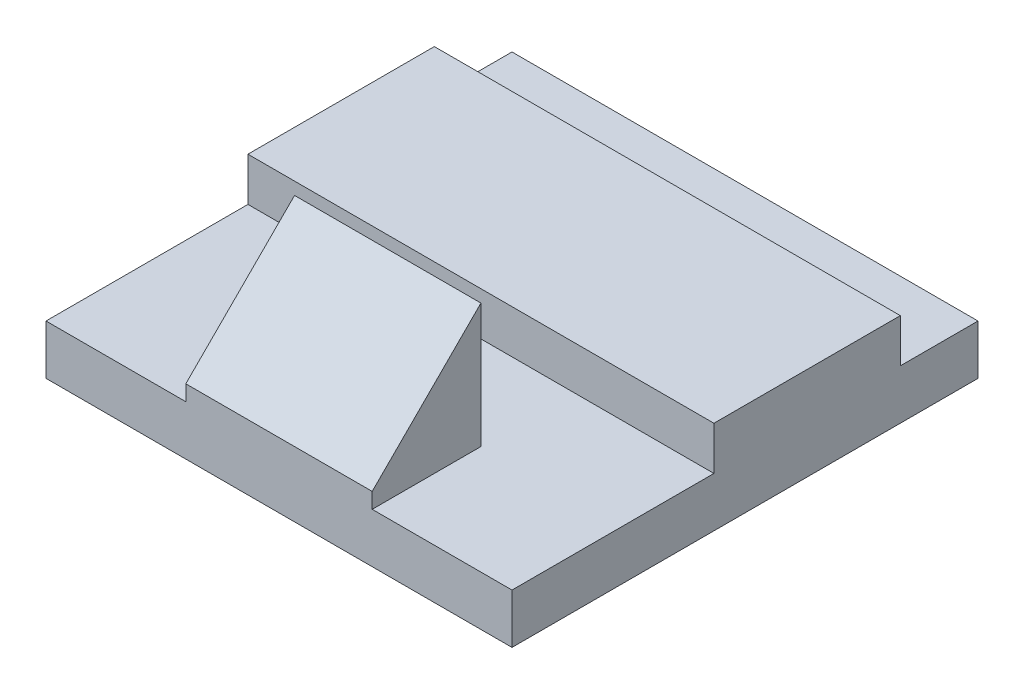
from build123d import *

# Parameters (mm, degrees)
SKETCH1_W           = 300
SKETCH1_H           = 300
BOSS_EXTRUDE1_DEPTH = 32
SKETCH2_W           = 300
SKETCH2_H           = 120
BOSS_EXTRUDE2_DEPTH = 28
SKETCH3_W           = 120
SKETCH3_H           = 70
BOSS_EXTRUDE3_DEPTH = 80
CUT_EXTRUDE1_DEPTH  = 120


with BuildPart() as part:
    # Sketch1 → Boss-Extrude1 (new body)
    with BuildSketch(Plane(origin=(0, 0, 0), x_dir=(1, 0, 0), z_dir=(0, 1, 0))):
        Rectangle(SKETCH1_W, SKETCH1_H)
    extrude(amount=BOSS_EXTRUDE1_DEPTH)

    # Sketch2 → Boss-Extrude2 (add)
    with BuildSketch(Plane(origin=(0, 32, 0), x_dir=(1, 0, 0), z_dir=(0, 1, 0))):
        with Locations((0, 40)):
            Rectangle(SKETCH2_W, SKETCH2_H)
    extrude(amount=BOSS_EXTRUDE2_DEPTH)

    # Sketch3 → Boss-Extrude3 (add)
    with BuildSketch(Plane(origin=(0, 32, 0), x_dir=(1, 0, 0), z_dir=(0, 1, 0))):
        with Locations((0, -115)):
            Rectangle(SKETCH3_W, SKETCH3_H)
    extrude(amount=BOSS_EXTRUDE3_DEPTH)

    # Sketch4 → Cut-Extrude1 (cut)
    with BuildSketch(Plane(origin=(60, 0, 0), x_dir=(0, 0, -1), z_dir=(1, 0, 0))):
        Polygon((-80, 112), (-150, 42), (-150, 112), align=None)
    extrude(amount=-CUT_EXTRUDE1_DEPTH, mode=Mode.SUBTRACT)


solid = part.part
